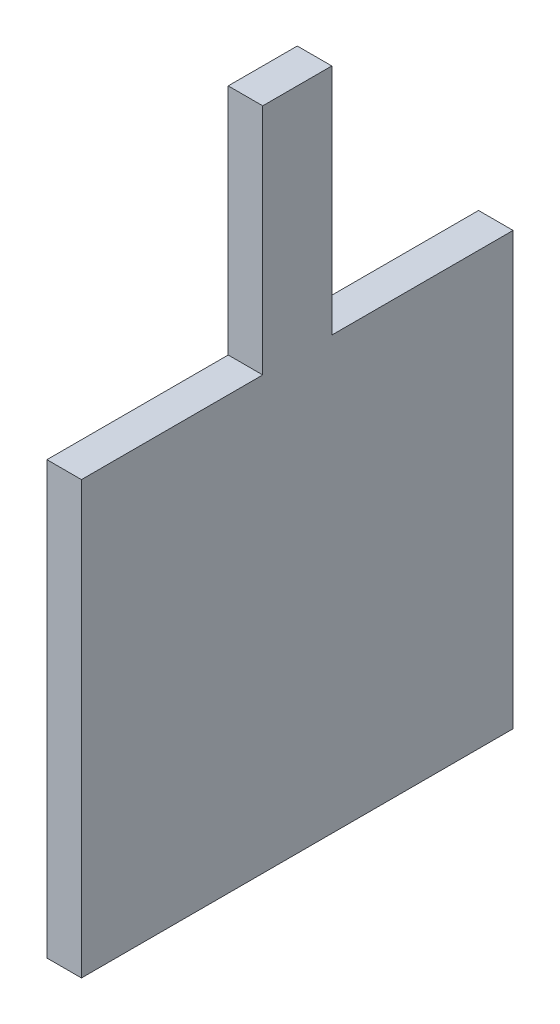
from build123d import *

# Parameters (mm, degrees)
BOSS_EXTRUDE1_DEPTH = 4


with BuildPart() as part:
    # Sketch1 → Boss-Extrude1 (new body)
    with BuildSketch(Plane(origin=(0, 0, 0), x_dir=(0, 0, -1), z_dir=(1, 0, 0))):
        Polygon((0, 0), (0, 27), (8, 27), (8, 0), (29, 0), (29, -50), (-21, -50), (-21, 0), align=None)
    extrude(amount=BOSS_EXTRUDE1_DEPTH)


solid = part.part
